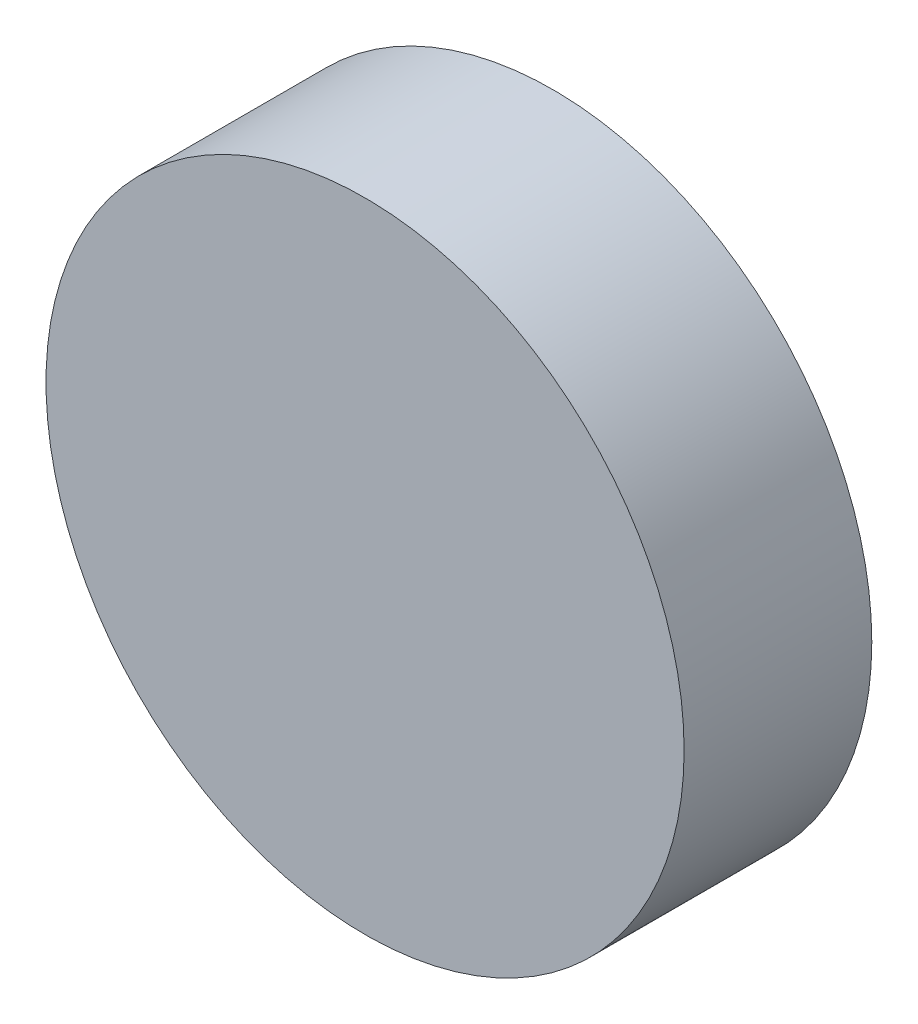
from build123d import *

# Parameters (mm, degrees)
SZKIC1_R                    = 17
DODANIE_WYCI_GNI_CIE1_DEPTH = 10


with BuildPart() as part:
    # Szkic1 → Dodanie-wyciągnięcie1 (new body)
    with BuildSketch(Plane.XY):
        Circle(SZKIC1_R)
    extrude(amount=DODANIE_WYCI_GNI_CIE1_DEPTH)


solid = part.part
